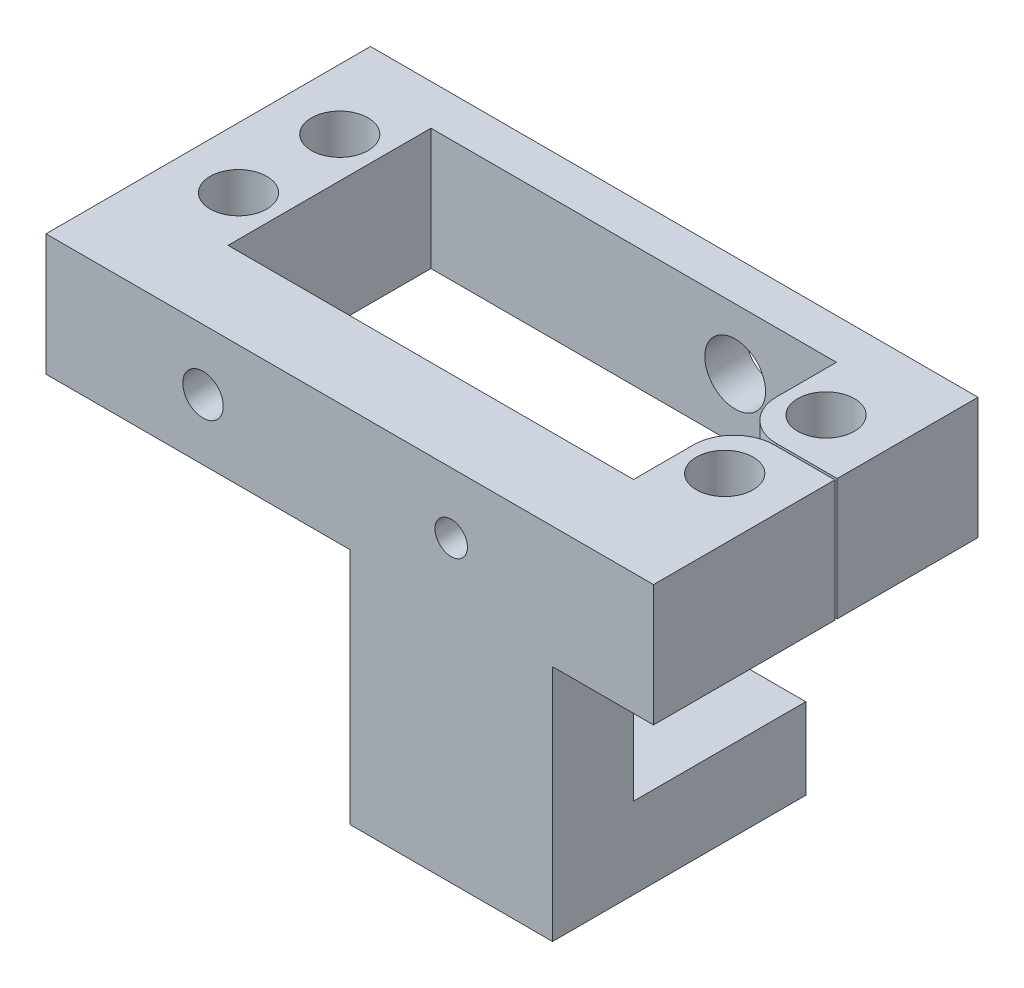
from build123d import *

# Parameters (mm, degrees)
SKETCH1_R               = 2.8
SKETCH1_W               = 55.97
SKETCH1_H               = 4
SKETCH1_W_2             = 2
BOSS_EXTRUDE1_DEPTH     = 6
SKETCH2_R               = 2.8
BOSS_EXTRUDE2_DEPTH     = 3.5
SKETCH3_R               = 1.6
CUT_EXTRUDE1_DEPTH      = 10
SKETCH4_R               = 3
CUT_EXTRUDE2_DEPTH      = 28.03
BOSS_EXTRUDE3_DEPTH     = 20.015
SKETCH6_R               = 2
CUT_EXTRUDE3_DEPTH      = 6
CUT_EXTRUDE6_DEPTH      = 53.87032367
CUT_EXTRUDE6_DEPTH_BACK = 8
SKETCH10_R              = 2


with BuildPart() as part:
    # Sketch1 → Boss-Extrude1 (new, symmetric)
    # profile 1 of 8: a face of its own
    with BuildSketch(Plane(origin=(0, 0, 0), x_dir=(1, 0, 0), z_dir=(0, 1, 0))):
        with BuildLine():
            ThreePointArc((24, -0.115), (21.182179477, -1.282179477), (20.015, -4.1))
            Line((20.015, -4.1), (20.015, -10.015))
            Line((20.015, -10.015), (-20.015, -10.015))
            Line((-20.015, -10.015), (-20.015, 10.015))
            Line((-20.015, 10.015), (20.015, 10.015))
            Line((20.015, 10.015), (20.015, 4.1))
            ThreePointArc((20.015, 4.1), (21.182179477, 1.282179477), (24, 0.115))
            ThreePointArc((24, 0.115), (26.817820523, 1.282179477), (27.985, 4.1))
            Line((27.985, 4.1), (27.985, 14.015))
            Line((27.985, 14.015), (-27.985, 14.015))
            Line((-27.985, 14.015), (-27.985, -14.015))
            Line((-27.985, -14.015), (27.985, -14.015))
            Line((27.985, -14.015), (27.985, -4.1))
            ThreePointArc((27.985, -4.1), (26.817820523, -1.282179477), (24, -0.115))
        make_face()
        with Locations(Location((-24, -5, 0), (0, 0, 270))):
            Circle(SKETCH1_R, mode=Mode.SUBTRACT)
        with Locations(Location((-24, 5, 0), (0, 0, 270))):
            Circle(SKETCH1_R, mode=Mode.SUBTRACT)
        with Locations(Location((24, -5, 0), (0, 0, 270))):
            Circle(SKETCH1_R, mode=Mode.SUBTRACT)
        with Locations(Location((24, 5, 0), (0, 0, 270))):
            Circle(SKETCH1_R, mode=Mode.SUBTRACT)
    # profile 2 of 8: a face of its own
    with BuildSketch(Plane(origin=(0, 0, 0), x_dir=(1, 0, 0), z_dir=(0, 1, 0))):
        with Locations((0, -16.015)):
            Rectangle(SKETCH1_W, SKETCH1_H)
    # profile 3 of 8: a face of its own
    with BuildSketch(Plane(origin=(0, 0, 0), x_dir=(1, 0, 0), z_dir=(0, 1, 0))):
        Polygon((27.985, 4.1), (27.985, 0.115), (29.985, 0.115), (29.985, 14.015), (27.985, 14.015), align=None)
    # profile 4 of 8: a face of its own
    with BuildSketch(Plane(origin=(0, 0, 0), x_dir=(1, 0, 0), z_dir=(0, 1, 0))):
        Polygon((29.985, -0.115), (27.985, -0.115), (27.985, -4.1), (27.985, -14.015), (29.985, -14.015), align=None)
    # profile 5 of 8: a face of its own
    with BuildSketch(Plane(origin=(0, 0, 0), x_dir=(1, 0, 0), z_dir=(0, 1, 0))):
        with BuildLine():
            Line((27.985, -4.1), (27.985, -0.115))
            Line((27.985, -0.115), (24, -0.115))
            ThreePointArc((24, -0.115), (26.817820523, -1.282179477), (27.985, -4.1))
        make_face()
    # profile 6 of 8: a face of its own
    with BuildSketch(Plane(origin=(0, 0, 0), x_dir=(1, 0, 0), z_dir=(0, 1, 0))):
        with BuildLine():
            Line((24, 0.115), (27.985, 0.115))
            Line((27.985, 0.115), (27.985, 4.1))
            ThreePointArc((27.985, 4.1), (26.817820523, 1.282179477), (24, 0.115))
        make_face()
    # profile 7 of 8: a face of its own
    with BuildSketch(Plane(origin=(0, 0, 0), x_dir=(1, 0, 0), z_dir=(0, 1, 0))):
        with Locations((28.985, -16.015)):
            Rectangle(SKETCH1_W_2, SKETCH1_H)
    # profile 8 of 8: a face of its own
    with BuildSketch(Plane(origin=(0, 0, 0), x_dir=(1, 0, 0), z_dir=(0, 1, 0))):
        Polygon((-29.985, 14.015), (-29.985, -18.015), (-27.985, -18.015), (-27.985, -14.015), (-27.985, 14.015), align=None)
    extrude(amount=BOSS_EXTRUDE1_DEPTH, both=True)

    # Sketch2 → Boss-Extrude2 (add)
    with BuildSketch(Plane.XZ.offset(6)):
        with Locations(Location((24, -5, 0), (0, 0, 90))):
            Circle(SKETCH2_R)
        with Locations(Location((24, 5, 0), (0, 0, 90))):
            Circle(SKETCH2_R)
        with Locations(Location((-24, -5, 0), (0, 0, 90))):
            Circle(SKETCH2_R)
        with Locations(Location((-24, 5, 0), (0, 0, 90))):
            Circle(SKETCH2_R)
    extrude(amount=-BOSS_EXTRUDE2_DEPTH)

    # Sketch3 → Cut-Extrude1 (cut)
    with BuildSketch(Plane.XY.offset(18.015)):
        with Locations((10.015, 0)):
            Circle(SKETCH3_R)
    extrude(amount=-CUT_EXTRUDE1_DEPTH, mode=Mode.SUBTRACT)

    # Sketch4 → Cut-Extrude2 (cut)
    with BuildSketch(Plane(origin=(0, 0, -14.015), x_dir=(-1, 0, 0), z_dir=(0, 0, -1))):
        with Locations((-10.015, 0)):
            Circle(SKETCH4_R)
    extrude(amount=-CUT_EXTRUDE2_DEPTH, mode=Mode.SUBTRACT)

    # Sketch5 → Boss-Extrude3 (add)
    with BuildSketch(Plane(origin=(0, 0, 0), x_dir=(0, 0, -1), z_dir=(1, 0, 0))):
        Polygon((-18.015, -6), (-10.015, -6), (-10.015, -21.5), (6.985, -21.5), (6.985, -29.5), (-18.015, -29.5), align=None)
    extrude(amount=BOSS_EXTRUDE3_DEPTH)

    # Sketch6 → Cut-Extrude3 (cut)
    with BuildSketch(Plane.XZ.offset(29.5)):
        with Locations(Location((10.015, 0, 0), (0, 0, 270))):
            Circle(SKETCH6_R)
    extrude(amount=-CUT_EXTRUDE3_DEPTH, mode=Mode.SUBTRACT)

    # Sketch10 → Cut-Extrude6 (cut, two sides: drawn at the far end of the back side and taken through both)
    with BuildSketch(Plane.XY.offset(18.015).offset(-CUT_EXTRUDE6_DEPTH_BACK)):
        with Locations(Location((-14.485, 0, 0), (0, 0, 180))):
            Circle(SKETCH10_R)
    extrude(amount=CUT_EXTRUDE6_DEPTH + CUT_EXTRUDE6_DEPTH_BACK, mode=Mode.SUBTRACT)


solid = part.part
